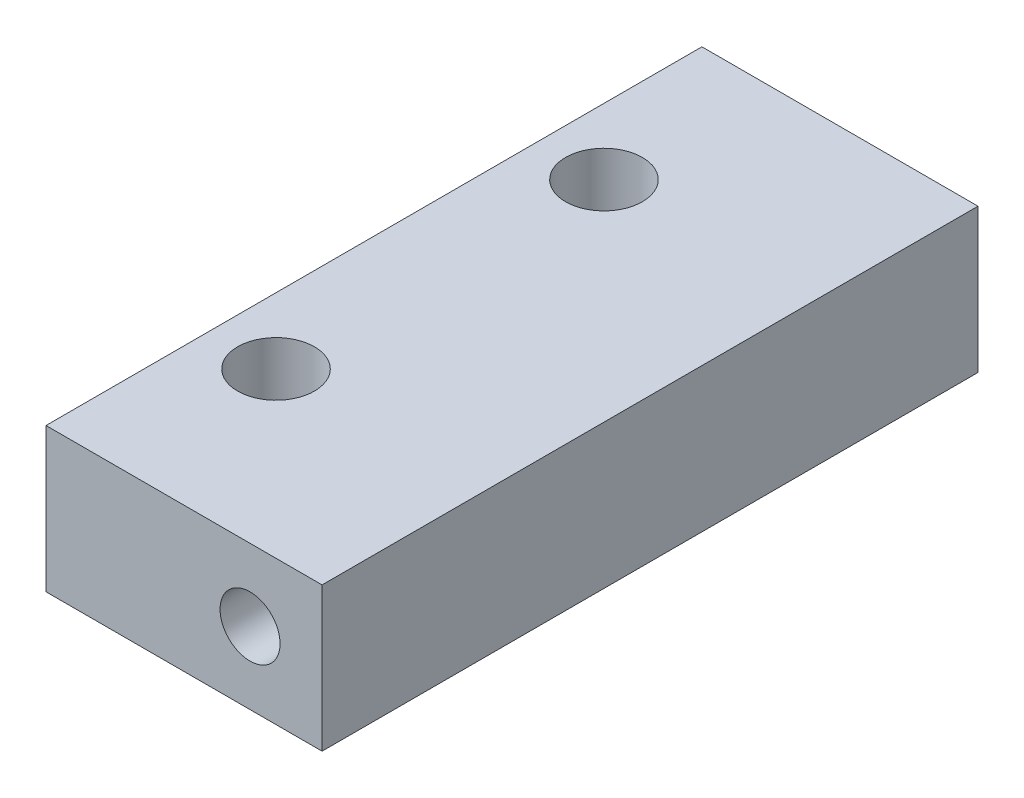
from build123d import *

# Parameters (mm, degrees)
BOSS_EXTRUDE1_DEPTH = 6
SKETCH2_R           = 1.25
CUT_EXTRUDE1_DEPTH  = 31.245600159


with BuildPart() as part:
    # Sketch1 → Boss-Extrude1 (new body)
    with BuildSketch(Plane(origin=(0, 0, 0), x_dir=(1, 0, 0), z_dir=(0, 1, 0))):
        with BuildLine():
            Line((5.5, 27.323), (2.75, 27.323))
            Line((2.75, 27.323), (2.75, 22.092))
            ThreePointArc((2.75, 22.092), (3.88137085, 21.62337085), (4.35, 20.492))
            ThreePointArc((4.35, 20.492), (3.88137085, 19.36062915), (2.75, 18.892))
            Line((2.75, 18.892), (2.75, 13.6615))
            Line((2.75, 13.6615), (2.75, 8.431))
            ThreePointArc((2.75, 8.431), (3.88137085, 7.96237085), (4.35, 6.831))
            ThreePointArc((4.35, 6.831), (3.88137085, 5.69962915), (2.75, 5.231))
            Line((2.75, 5.231), (2.75, 0))
            Line((2.75, 0), (11.5, 0))
            Line((11.5, 0), (11.5, 27.323))
            Line((11.5, 27.323), (5.5, 27.323))
        make_face()
        with BuildLine():
            Line((2.75, 27.323), (0, 27.323))
            Line((0, 27.323), (0, 0))
            Line((0, 0), (2.75, 0))
            Line((2.75, 0), (2.75, 5.231))
            ThreePointArc((2.75, 5.231), (1.15, 6.831), (2.75, 8.431))
            Line((2.75, 8.431), (2.75, 13.6615))
            Line((2.75, 13.6615), (2.75, 18.892))
            ThreePointArc((2.75, 18.892), (1.15, 20.492), (2.75, 22.092))
            Line((2.75, 22.092), (2.75, 27.323))
        make_face()
    extrude(amount=BOSS_EXTRUDE1_DEPTH)

    # Sketch2 → Cut-Extrude1 (cut, through all)
    with BuildSketch(Plane.XY):
        with Locations((8.5, 3)):
            Circle(SKETCH2_R)
    extrude(amount=-CUT_EXTRUDE1_DEPTH, mode=Mode.SUBTRACT)


solid = part.part
